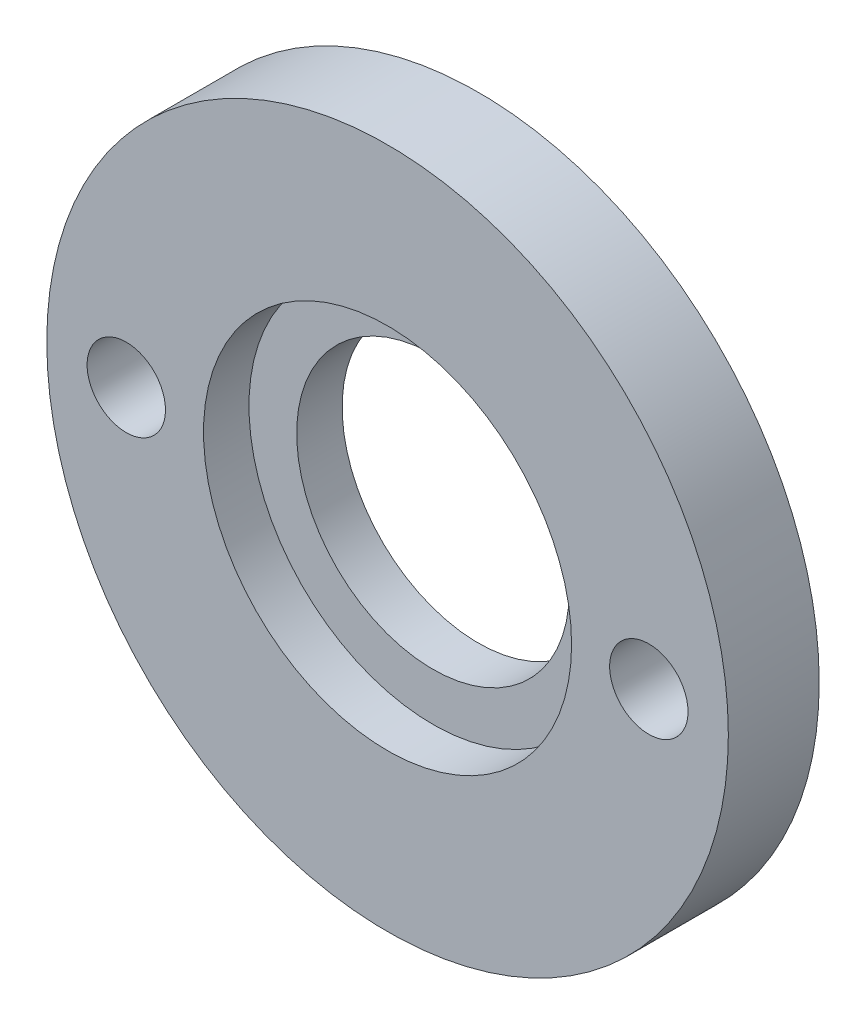
from build123d import *

# Parameters (mm, degrees)
SKETCH1_R           = 15
SKETCH1_R_2         = 6
SKETCH1_R_3         = 1.725
BOSS_EXTRUDE1_DEPTH = 4
CUT_EXTRUDE1_START  = -2
SKETCH2_R           = 8.1
SKETCH2_R_2         = 6
CUT_EXTRUDE1_DEPTH  = 2


with BuildPart() as part:
    # Sketch1 → Boss-Extrude1 (new body)
    with BuildSketch(Plane.XY):
        Circle(SKETCH1_R)
        Circle(SKETCH1_R_2, mode=Mode.SUBTRACT)
        with Locations((-11.5, 0)):
            Circle(SKETCH1_R_3, mode=Mode.SUBTRACT)
        with Locations((11.5, 0)):
            Circle(SKETCH1_R_3, mode=Mode.SUBTRACT)
    extrude(amount=BOSS_EXTRUDE1_DEPTH)

    # Sketch2 → Cut-Extrude1 (cut)
    with BuildSketch(Plane.XY.offset(4).offset(CUT_EXTRUDE1_START)):
        Circle(SKETCH2_R)
        Circle(SKETCH2_R_2, mode=Mode.SUBTRACT)
    extrude(amount=CUT_EXTRUDE1_DEPTH, mode=Mode.SUBTRACT)


solid = part.part
